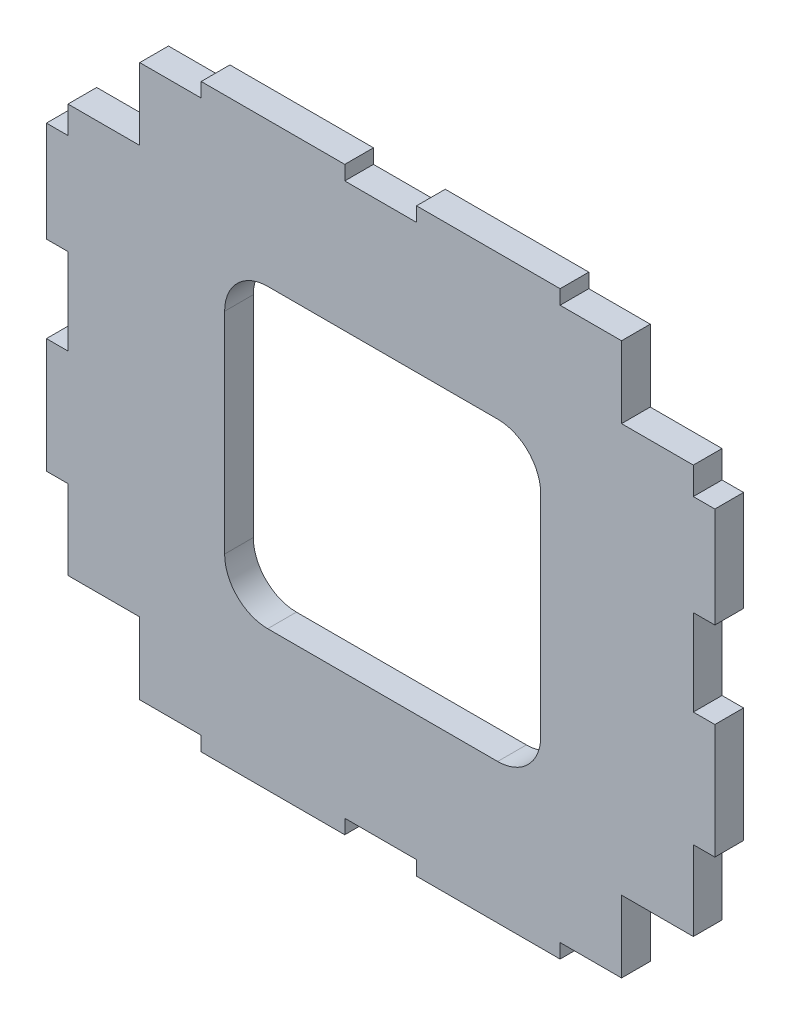
from build123d import *

# Parameters (mm, degrees)
EXTRUDE_1_DEPTH = 2


with BuildPart() as part:
    # Model → 凸台-拉伸1 (new body)
    with BuildSketch(Plane.XY):
        Polygon((32.060999065, 47.930306361), (36.340999065, 47.930306361), (36.340999065, 48.930662067), (46.340999065, 48.930662067), (46.340999065, 47.930306361), (51.340999065, 47.930306361), (51.340999065, 48.930662067), (61.340999065, 48.930662067), (61.340999065, 47.930306361), (65.620999065, 47.930306361), (65.620999065, 42.930306361), (70.620999065, 42.930306361), (70.620999065, 41.030306361), (72.120999065, 41.030306361), (72.120999065, 34.030306361), (70.620999065, 34.030306361), (70.620999065, 28.030306361), (72.120999065, 28.030306361), (72.120999065, 20.030306361), (70.620999065, 20.030306361), (70.620999065, 14.488230775), (65.620999065, 14.488230775), (65.620999065, 9.488230775), (61.340999065, 9.488230775), (61.340999065, 8.487875069), (51.340999065, 8.487875069), (51.340999065, 9.488230775), (46.340999065, 9.488230775), (46.340999065, 8.487875069), (36.340999065, 8.487875069), (36.340999065, 9.488230775), (32.060999065, 9.488230775), (32.060999065, 14.488230775), (27.060999065, 14.488230775), (27.060999065, 20.030306361), (25.560999065, 20.030306361), (25.560999065, 28.030306361), (27.060999065, 28.030306361), (27.060999065, 34.030306361), (25.560999065, 34.030306361), (25.560999065, 41.030306361), (27.060999065, 41.030306361), (27.060999065, 42.930306361), (32.060999065, 42.930306361), align=None)
        with BuildLine():
            Line((56.992719614, 38.886063343), (40.972719614, 38.886063343))
            ThreePointArc((40.972719614, 38.886063343), (38.85139927, 38.007383686), (37.972719614, 35.886063343))
            Line((37.972719614, 35.886063343), (37.972719614, 21.236063342))
            ThreePointArc((37.972719614, 21.236063342), (38.85139927, 19.114742999), (40.972719614, 18.236063342))
            Line((40.972719614, 18.236063342), (56.992719614, 18.236063342))
            ThreePointArc((56.992719614, 18.236063342), (59.114039957, 19.114742999), (59.992719614, 21.236063342))
            Line((59.992719614, 21.236063342), (59.992719614, 35.886063343))
            ThreePointArc((59.992719614, 35.886063343), (59.114039957, 38.007383686), (56.992719614, 38.886063343))
        make_face(mode=Mode.SUBTRACT)
    extrude(amount=EXTRUDE_1_DEPTH)


solid = part.part
